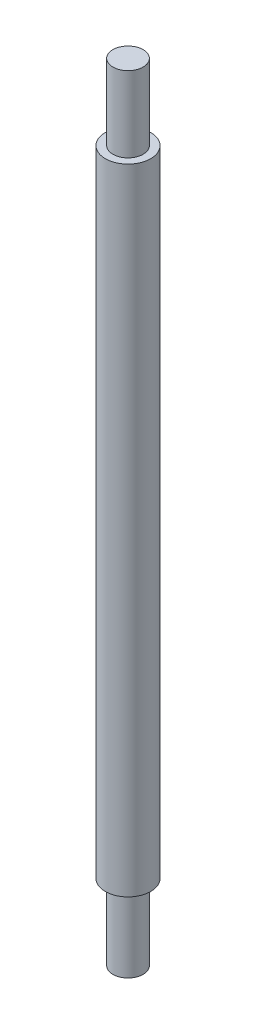
from build123d import *

# Parameters (mm, degrees)
SKETCH1_R           = 3
BOSS_EXTRUDE1_DEPTH = 42
SKETCH2_R           = 2
BOSS_EXTRUDE2_DEPTH = 10
BOSS_EXTRUDE3_START = 10
SKETCH3_R           = 2
BOSS_EXTRUDE3_DEPTH = 10


with BuildPart() as part:
    # Sketch1 → Boss-Extrude1 (new, symmetric)
    with BuildSketch(Plane(origin=(0, 0, 0), x_dir=(1, 0, 0), z_dir=(0, 1, 0))):
        with Locations(Location((0, 0, 0), (0, 0, 90))):
            Circle(SKETCH1_R)
    extrude(amount=BOSS_EXTRUDE1_DEPTH, both=True)

    # Sketch2 → Boss-Extrude2 (add)
    with BuildSketch(Plane(origin=(0, 42, 0), x_dir=(1, 0, 0), z_dir=(0, 1, 0))):
        with Locations(Location((0, 0, 0), (0, 0, 270))):
            Circle(SKETCH2_R)
    extrude(amount=BOSS_EXTRUDE2_DEPTH)

    # Sketch3 → Boss-Extrude3 (add)
    with BuildSketch(Plane.XZ.offset(42).offset(BOSS_EXTRUDE3_START)):
        with Locations(Location((0, 0, 0), (0, 0, 90))):
            Circle(SKETCH3_R)
    extrude(amount=-BOSS_EXTRUDE3_DEPTH)


solid = part.part
